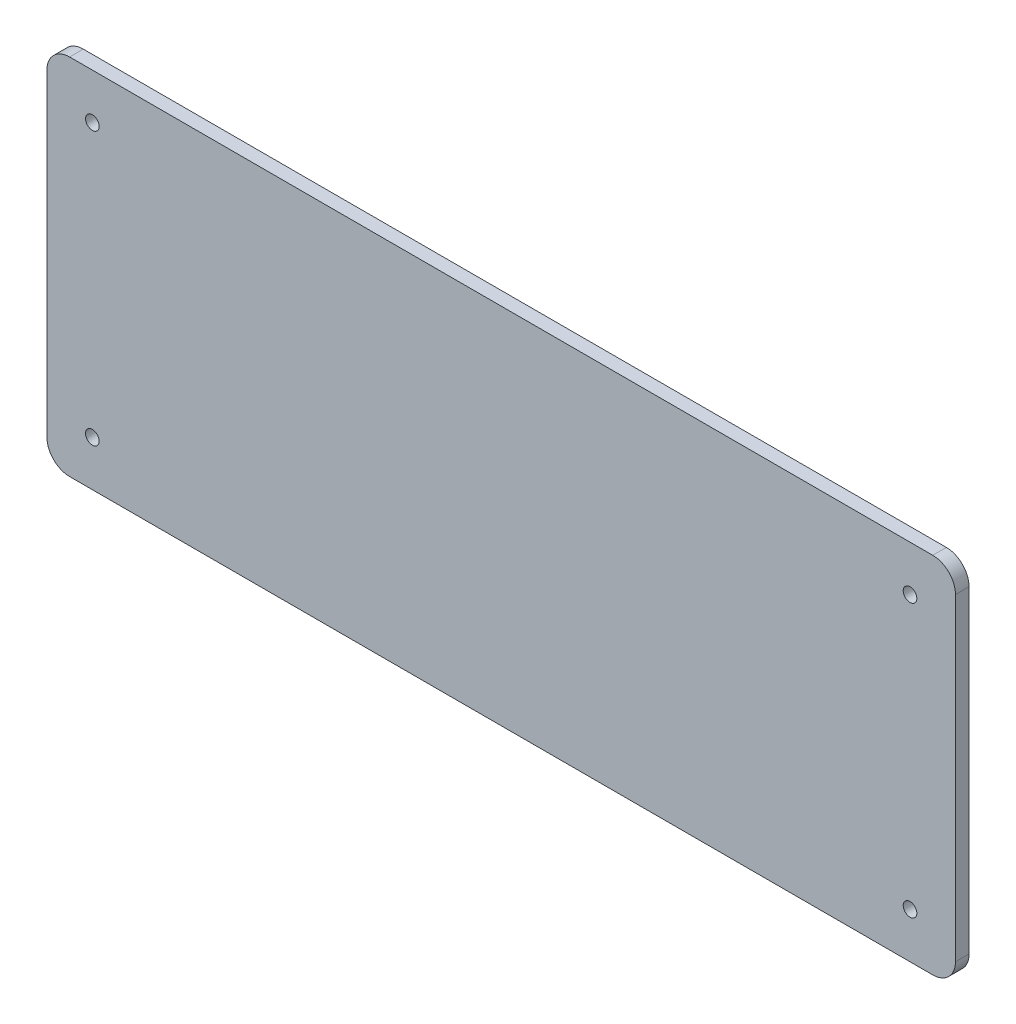
from build123d import *

# Parameters (mm, degrees)
ESBO_O1_R                = 1.5
RESSALTO_EXTRUS_O1_DEPTH = 3


with BuildPart() as part:
    # Esboço1 → Ressalto-extrusão1 (new body)
    with BuildSketch(Plane.XY):
        with BuildLine():
            Line((95, -40), (-95, -40))
            ThreePointArc((-95, -40), (-98.535533906, -38.535533906), (-100, -35))
            Line((-100, -35), (-100, 35))
            ThreePointArc((-100, 35), (-98.535533906, 38.535533906), (-95, 40))
            Line((-95, 40), (95, 40))
            ThreePointArc((95, 40), (98.535533906, 38.535533906), (100, 35))
            Line((100, 35), (100, -35))
            ThreePointArc((100, -35), (98.535533906, -38.535533906), (95, -40))
        make_face()
        with Locations((-90, 30)):
            Circle(ESBO_O1_R, mode=Mode.SUBTRACT)
        with Locations((90, 30)):
            Circle(ESBO_O1_R, mode=Mode.SUBTRACT)
        with Locations((90, -30)):
            Circle(ESBO_O1_R, mode=Mode.SUBTRACT)
        with Locations((-90, -30)):
            Circle(ESBO_O1_R, mode=Mode.SUBTRACT)
    extrude(amount=RESSALTO_EXTRUS_O1_DEPTH)


solid = part.part
